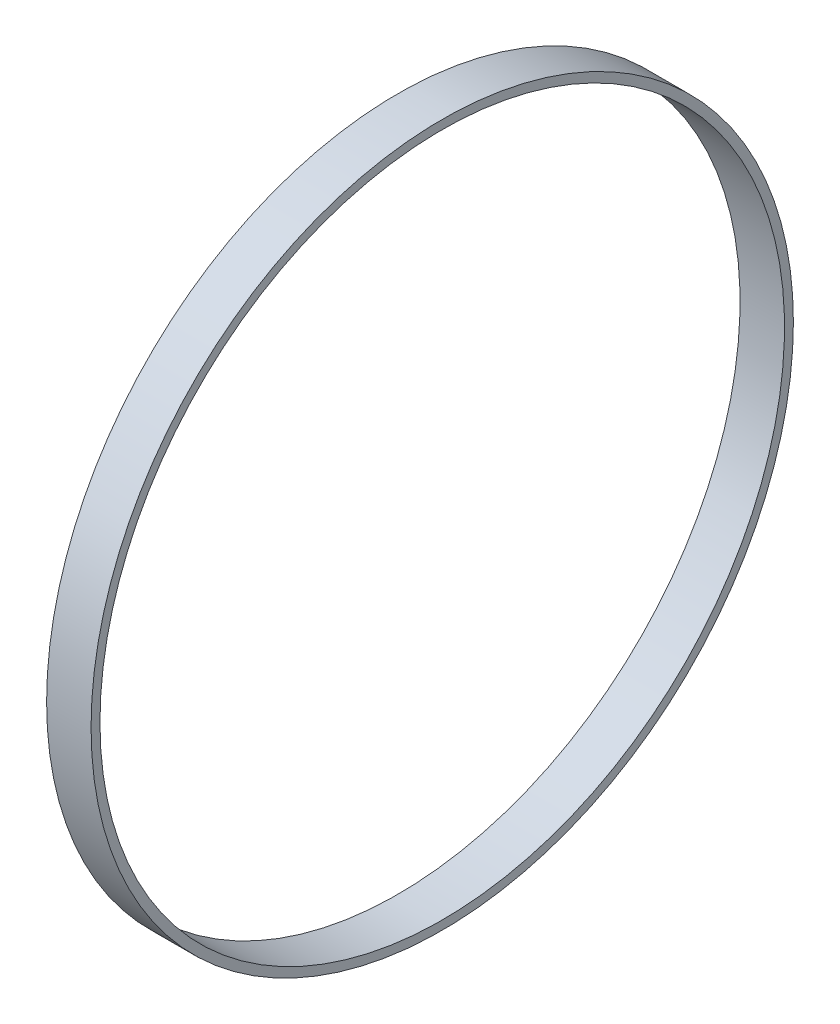
from build123d import *

# Parameters (mm, degrees)
SKETCH1_W = 50
SKETCH1_H = 10


with BuildPart() as part:
    # Sketch1 → Revolve1 (revolve)
    with BuildSketch(Plane(origin=(0, 0, 0), x_dir=(1, 0, 0), z_dir=(0, 1, 0)), mode=Mode.PRIVATE) as revolve1_sk:
        Rectangle(SKETCH1_W, SKETCH1_H)
    revolve(revolve1_sk.sketch.rotate(Axis((-20.782287599, 0, 390), (1, 0, 0)), 180), axis=Axis((-20.782287599, 0, 390), (1, 0, 0)))


solid = part.part
